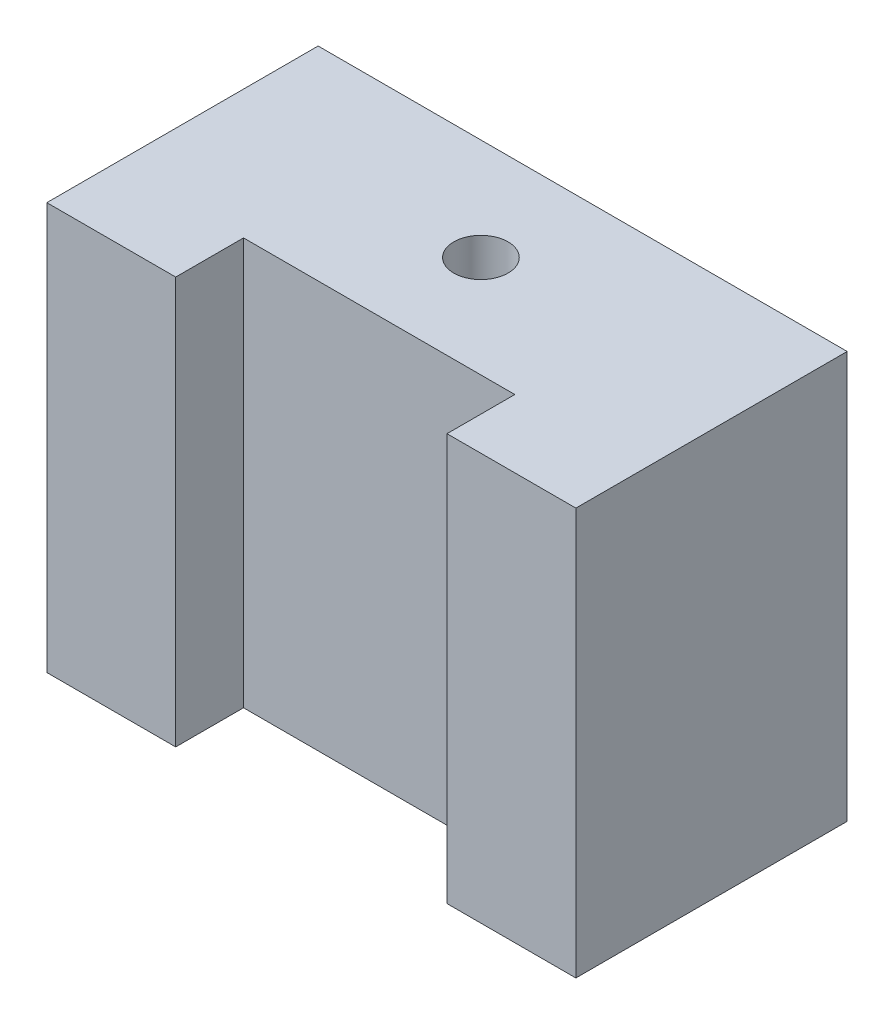
from build123d import *

# Parameters (mm, degrees)
SKETCH_1_W          = 78
SKETCH_1_H          = 60
EXTRUDE_1_DEPTH     = 30
SKETCH_2_W          = 19
SKETCH_2_H          = 60
EXTRUDE_2_DEPTH     = 10
SKETCH_3_R          = 4
CUT_EXTRUDE_1_DEPTH = 60


with BuildPart() as part:
    # 草图1 → 凸台-拉伸1 (new body)
    with BuildSketch(Plane.XY):
        Rectangle(SKETCH_1_W, SKETCH_1_H)
    extrude(amount=EXTRUDE_1_DEPTH)

    # 草图2 → 凸台-拉伸2 (add)
    with BuildSketch(Plane.XY.offset(30)):
        with Locations((29.5, 0)):
            Rectangle(SKETCH_2_W, SKETCH_2_H)
        with Locations((-29.5, 0)):
            Rectangle(SKETCH_2_W, SKETCH_2_H)
    extrude(amount=EXTRUDE_2_DEPTH)

    # 草图3 → 切除-拉伸1 (cut)
    with BuildSketch(Plane(origin=(0, 30, 0), x_dir=(1, 0, 0), z_dir=(0, 1, 0))):
        with Locations(Location((0, -15, 0), (0, 0, 270))):
            Circle(SKETCH_3_R)
    extrude(amount=-CUT_EXTRUDE_1_DEPTH, mode=Mode.SUBTRACT)


solid = part.part
